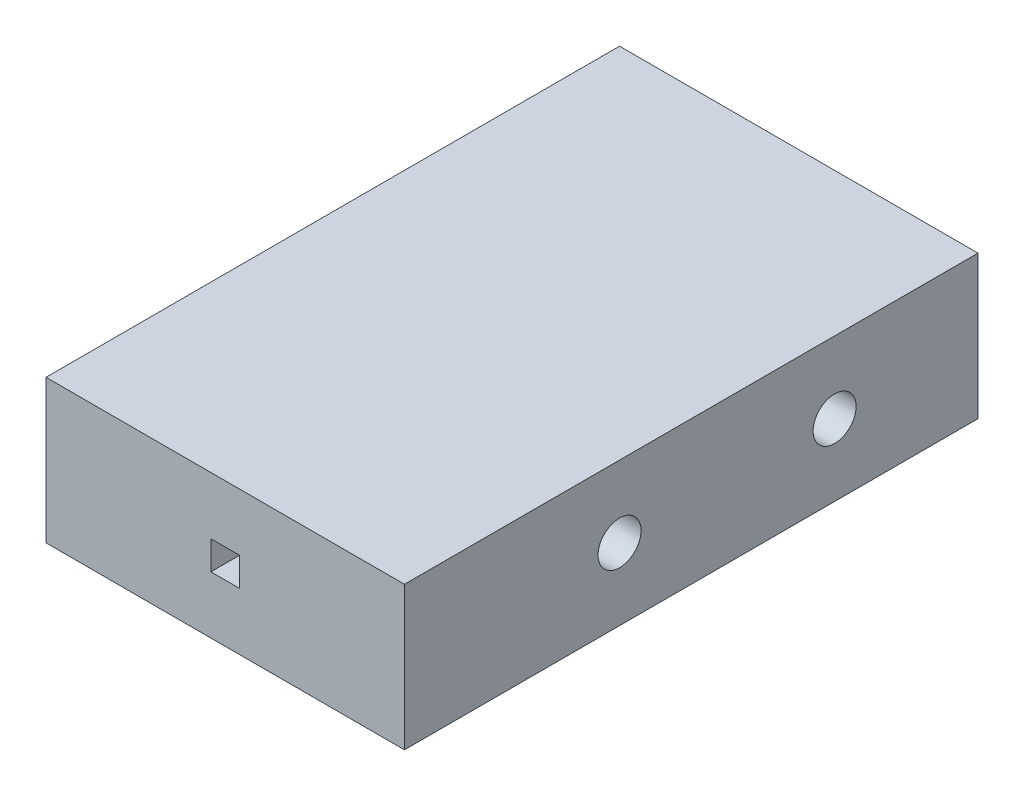
from build123d import *

# Parameters (mm, degrees)
SKETCH1_W           = 25
SKETCH1_H           = 40
BOSS_EXTRUDE1_DEPTH = 10
SKETCH2_R           = 1.5
CUT_EXTRUDE1_DEPTH  = 34.541019662
SKETCH4_R           = 1.5
CUT_EXTRUDE3_DEPTH  = 34.541019662
SKETCH6_W           = 2
SKETCH6_H           = 2
CUT_EXTRUDE4_DEPTH  = 44.084219849


with BuildPart() as part:
    # Sketch1 → Boss-Extrude1 (new body)
    with BuildSketch(Plane(origin=(0, 0, 0), x_dir=(1, 0, 0), z_dir=(0, 1, 0))):
        Rectangle(SKETCH1_W, SKETCH1_H)
    extrude(amount=BOSS_EXTRUDE1_DEPTH)

    # Sketch2 → Cut-Extrude1 (cut, through all)
    with BuildSketch(Plane(origin=(12.5, 0, 0), x_dir=(0, 0, -1), z_dir=(1, 0, 0))):
        with Locations((10, 5)):
            Circle(SKETCH2_R)
    extrude(amount=-CUT_EXTRUDE1_DEPTH, mode=Mode.SUBTRACT)

    # Sketch4 → Cut-Extrude3 (cut, through all)
    with BuildSketch(Plane.ZY.offset(12.5)):
        with Locations((5, 5)):
            Circle(SKETCH4_R)
    extrude(amount=-CUT_EXTRUDE3_DEPTH, mode=Mode.SUBTRACT)

    # Sketch6 → Cut-Extrude4 (cut, through all)
    with BuildSketch(Plane.XY.offset(20)):
        with Locations((0, 5)):
            Rectangle(SKETCH6_W, SKETCH6_H)
    extrude(amount=-CUT_EXTRUDE4_DEPTH, mode=Mode.SUBTRACT)


solid = part.part
